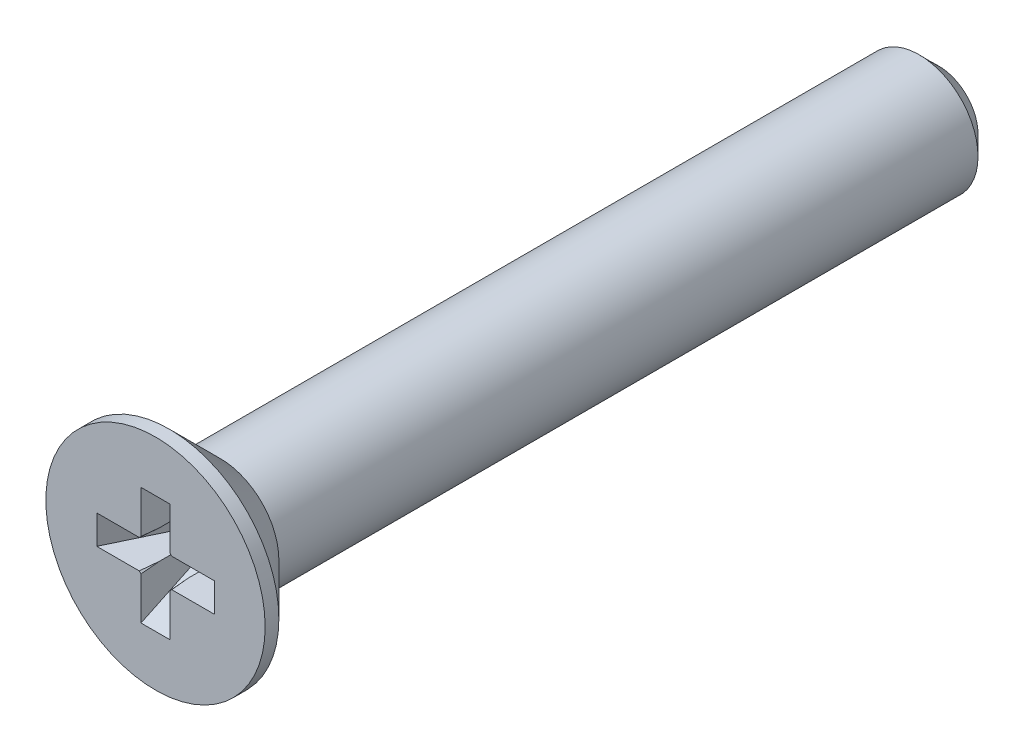
from build123d import *

# Parameters (mm, degrees)
PATTERN_CIRCULAR_1_COUNT = 2
PATTERN_CIRCULAR_1_ANGLE = 90
CHAMFER_1_SIZE           = 0.5
MOVE_BODY_1_ANGLE        = 90


with BuildPart() as part:
    # Эскиз1 → Повернуть1 (revolve)
    with BuildSketch(Plane.XY, mode=Mode.PRIVATE) as revolve_1_sk:
        Polygon((0, 2.8), (0.35, 2.8), (1.65, 1.5), (20, 1.5), (20, 0), (0, 0), align=None)
    revolve(revolve_1_sk.sketch.rotate(Axis((-6.35, 0, 0), (1, 0, 0)), 90), axis=Axis((-6.35, 0, 0), (1, 0, 0)))

    # Эскиз2 → Вырез-По сечениям1 section 0
    with BuildSketch(Plane.ZY):
        with BuildLine():
            Line((-0.37, 1.5), (0.37, 1.5))
            Line((0.37, 1.5), (0.37, -1.5))
            Line((0.37, -1.5), (-0.37, -1.5))
            Line((-0.37, -1.5), (-0.37, 1.5))
        make_face()
    # Эскиз3 → Вырез-По сечениям1 section 1
    with BuildSketch(Plane.ZY.offset(-2.1)):
        with BuildLine():
            Line((-0.37, 0.498), (0.37, 0.498))
            Line((0.37, 0.498), (0.37, -0.498))
            Line((0.37, -0.498), (-0.37, -0.498))
            Line((-0.37, -0.498), (-0.37, 0.498))
        make_face()
    loft_1 = loft(mode=Mode.SUBTRACT)

    # Круговой массив1: Вырез-По сечениям1 ×2 about axis
    pattern_circular_1_axis = Axis((0, 0, 0), (-1, 0, 0))
    for i in range(1, PATTERN_CIRCULAR_1_COUNT):
        add(loft_1.rotate(pattern_circular_1_axis, i * PATTERN_CIRCULAR_1_ANGLE / (PATTERN_CIRCULAR_1_COUNT - 1)), mode=Mode.SUBTRACT)

    # Эскиз4 → Вырез-Повернуть1 (revolve, cut)
    with BuildSketch(Plane.XY, mode=Mode.PRIVATE) as cut_revolve_1_sk:
        Polygon((0, 0), (0, 0.556), (2.1, 0.409153695), (2.232942094, 0), align=None)
    revolve(cut_revolve_1_sk.sketch.rotate(Axis((-0.899228133, 0, 0), (-1, 0, 0)), 270), axis=Axis((-0.899228133, 0, 0), (-1, 0, 0)), mode=Mode.SUBTRACT)

    # Фаска1
    chamfer_1_edges = [part.edges().sort_by_distance(p)[0] for p in [
        (20, 0, -1.5),
    ]]
    chamfer(chamfer_1_edges, length=CHAMFER_1_SIZE)


with BuildPart() as part_1:
    # Move Body 1: moved
    add(part.part.rotate(Axis((0, 0, 0), (0, 1, 0)), MOVE_BODY_1_ANGLE))


solid = part_1.part
